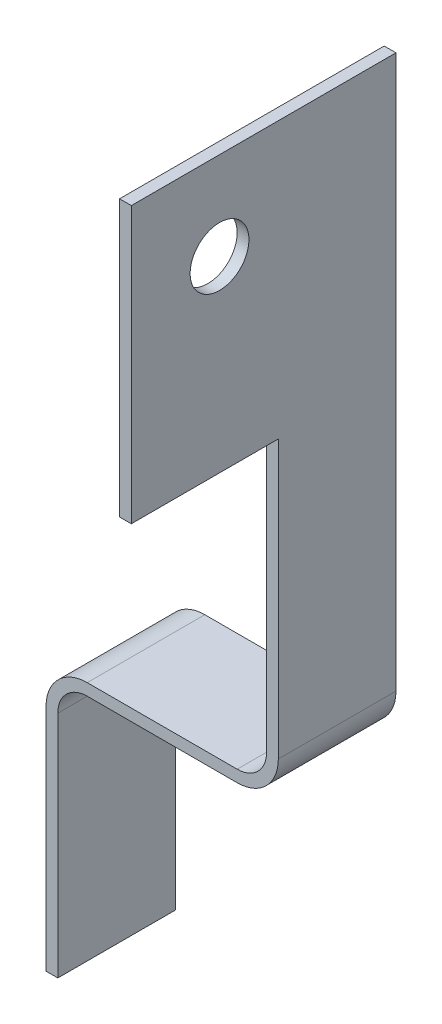
from build123d import *

# Parameters (mm, degrees)
SKETCH1_W           = 15.8
SKETCH1_H           = 58
BOSS_EXTRUDE1_DEPTH = 8
SKETCH2_W           = 15
SKETCH2_H           = 39.6
CUT_EXTRUDE1_DEPTH  = 191.395014145
SKETCH3_W           = 0.8
SKETCH3_H           = 18.745212198
BOSS_EXTRUDE2_DEPTH = 10
SKETCH4_W           = 15
SKETCH4_H           = 17.6
CUT_EXTRUDE2_DEPTH  = 191.489530975
HOLE1_D             = 4
FILLET1_R           = 2
FILLET2_R           = 2
FILLET3_R           = 2.8
FILLET4_R           = 2.8


with BuildPart() as part:
    # Sketch1 → Boss-Extrude1 (new body)
    with BuildSketch(Plane(origin=(0, 0, 293.029524909), x_dir=(-1, 0, 0), z_dir=(0, 0, -1))):
        with Locations((-167.5, 44.628129211)):
            Rectangle(SKETCH1_W, SKETCH1_H)
    extrude(amount=-BOSS_EXTRUDE1_DEPTH)

    # Sketch2 → Cut-Extrude1 (cut, through all)
    with BuildSketch(Plane(origin=(0, 0, 293.029524909), x_dir=(-1, 0, 0), z_dir=(0, 0, -1))):
        with Locations((-167.1, 53.828129211)):
            Rectangle(SKETCH2_W, SKETCH2_H)
    extrude(amount=-CUT_EXTRUDE1_DEPTH, mode=Mode.SUBTRACT)

    # Sketch3 → Boss-Extrude2 (add)
    with BuildSketch(Plane.XY.offset(301.029524909)):
        with Locations((175, 64.255523112)):
            Rectangle(SKETCH3_W, SKETCH3_H)
    extrude(amount=BOSS_EXTRUDE2_DEPTH)

    # Sketch4 → Cut-Extrude2 (cut, through all)
    with BuildSketch(Plane.XY.offset(301.029524909)):
        with Locations((167.9, 24.428129211)):
            Rectangle(SKETCH4_W, SKETCH4_H)
    extrude(amount=-CUT_EXTRUDE2_DEPTH, mode=Mode.SUBTRACT)

    # Hole1 (through all)
    with Locations(Plane.ZY.offset(-174.6)):
        with Locations((305.029524909, 67.628129211)):
            Hole(HOLE1_D / 2)

    # Fillet1
    fillet1_edges = [part.edges().sort_by_distance(p)[0] for p in [
        (160.4, 33.228129211, 297.029524909),
    ]]
    fillet(fillet1_edges, radius=FILLET1_R)

    # Fillet2
    fillet2_edges = [part.edges().sort_by_distance(p)[0] for p in [
        (174.6, 34.028129211, 297.029524909),
    ]]
    fillet(fillet2_edges, radius=FILLET2_R)

    # Fillet3
    fillet3_edges = [part.edges().sort_by_distance(p)[0] for p in [
        (159.6, 34.028129211, 297.029524909),
    ]]
    fillet(fillet3_edges, radius=FILLET3_R)

    # Fillet4
    fillet4_edges = [part.edges().sort_by_distance(p)[0] for p in [
        (175.4, 33.228129211, 297.029524909),
    ]]
    fillet(fillet4_edges, radius=FILLET4_R)


solid = part.part
